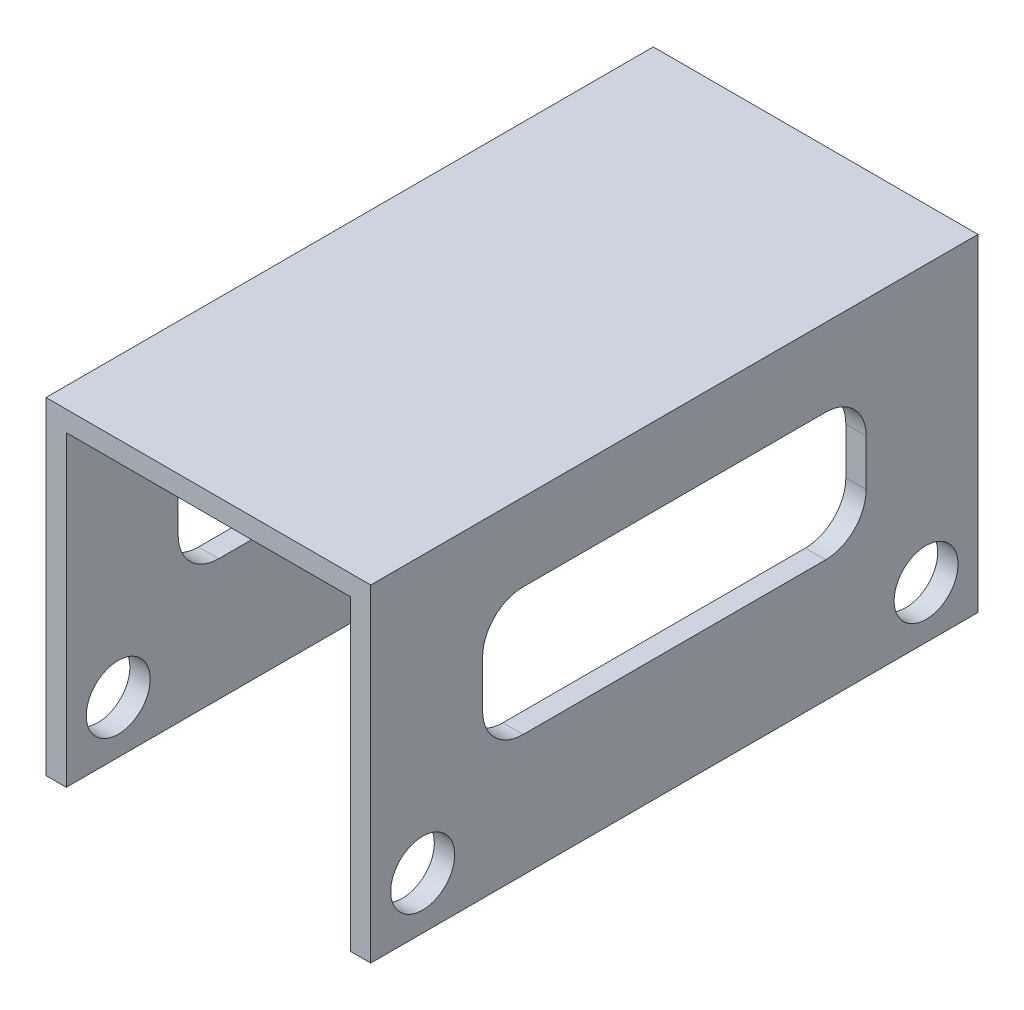
from build123d import *

# Parameters (mm, degrees)
SKETCH1_W               = 50.8
SKETCH1_H               = 76.2
SKETCH1_W_2             = 44.45
SKETCH1_H_2             = 69.85
BOSS_EXTRUDE1_DEPTH     = 95
CUT_EXTRUDE2_DEPTH      = 106.459802769
CUT_EXTRUDE2_DEPTH_BACK = 106.459802769
SKETCH3_R               = 5
SKETCH3_W               = 95
SKETCH3_H               = 24.975
SKETCH3_W_2             = 60
SKETCH3_H_2             = 20
FILLET2_R               = 6.35


with BuildPart() as part:
    # Sketch1 → Boss-Extrude1 (new body)
    with BuildSketch(Plane.XY):
        Rectangle(SKETCH1_W, SKETCH1_H)
        Rectangle(SKETCH1_W_2, SKETCH1_H_2, mode=Mode.SUBTRACT)
    extrude(amount=BOSS_EXTRUDE1_DEPTH)

    # Sketch3 → Cut-Extrude2 (cut, two sides: drawn at the far end of the back side and taken through both)
    with BuildSketch(Plane(origin=(0, 0, 0), x_dir=(0, 0, -1), z_dir=(1, 0, 0)).offset(-CUT_EXTRUDE2_DEPTH_BACK)):
        with Locations((-86.875, -5)):
            Circle(SKETCH3_R)
        with Locations(Location((-8.125, -5, 0), (0, 0, 270))):
            Circle(SKETCH3_R)
        with Locations((-47.5, -25.6125)):
            Rectangle(SKETCH3_W, SKETCH3_H)
        with Locations((-47.5, 15.925)):
            Rectangle(SKETCH3_W_2, SKETCH3_H_2)
    extrude(amount=CUT_EXTRUDE2_DEPTH + CUT_EXTRUDE2_DEPTH_BACK, mode=Mode.SUBTRACT)

    # Fillet2
    fillet2_edges = [part.edges().sort_by_distance(p)[0] for p in [
        (-23.8125, 25.925, 17.5),
        (-23.8125, 5.925, 17.5),
        (-23.8125, 5.925, 77.5),
        (-23.8125, 25.925, 77.5),
        (23.8125, 25.925, 17.5),
        (23.8125, 5.925, 17.5),
        (23.8125, 5.925, 77.5),
        (23.8125, 25.925, 77.5),
    ]]
    fillet(fillet2_edges, radius=FILLET2_R)


solid = part.part
